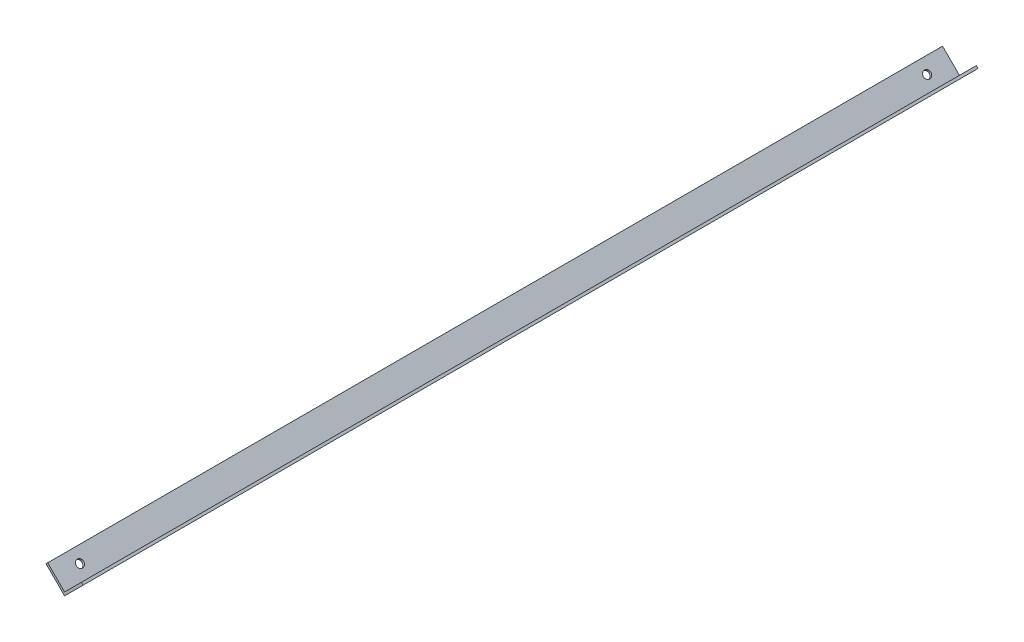
from build123d import *

# Parameters (mm, degrees)
BOSS_EXTRUDE1_DEPTH = 476.25
SKETCH2_R           = 1.984375
CUT_EXTRUDE1_DEPTH  = 477.43707659
SKETCH3_R           = 1.984375
CUT_EXTRUDE2_DEPTH  = 477.43707659
SKETCH4_R           = 1.984375
CUT_EXTRUDE3_DEPTH  = 477.43707659
SKETCH5_R           = 1.984375
CUT_EXTRUDE4_DEPTH  = 477.43707659


with BuildPart() as part:
    # Sketch1 → Boss-Extrude1 (new body)
    with BuildSketch(Plane.XY):
        Polygon((0, 0), (-8.980256121, 8.980256121), (-9.878281733, 8.082230509), (0, -1.796051224), (9.878281733, 8.082230509), (8.980256121, 8.980256121), align=None)
    extrude(amount=BOSS_EXTRUDE1_DEPTH)

    # Sketch2 → Cut-Extrude1 (cut, through all)
    with BuildSketch(Plane(origin=(0, 0, 0), x_dir=(0, 0, 1), z_dir=(-0.7071067811865469, 0.7071067811865481, 0))):
        with Locations(Location((469.9, 6.35, 0), (0, 0, 270))):
            Circle(SKETCH2_R)
        with Locations(Location((457.2, 6.35, 0), (0, 0, 270))):
            Circle(SKETCH2_R)
    extrude(amount=-CUT_EXTRUDE1_DEPTH, mode=Mode.SUBTRACT)

    # Sketch3 → Cut-Extrude2 (cut, through all)
    with BuildSketch(Plane(origin=(0, 0, 0), x_dir=(0, 0, -1), z_dir=(0.7071067811865483, 0.7071067811865468, 0))):
        with Locations(Location((-463.55, 6.35, 0), (0, 0, 90))):
            Circle(SKETCH3_R)
    extrude(amount=-CUT_EXTRUDE2_DEPTH, mode=Mode.SUBTRACT)

    # Sketch4 → Cut-Extrude3 (cut, through all)
    with BuildSketch(Plane(origin=(0, 0, 0), x_dir=(0, 0, 1), z_dir=(-0.7071067811865471, 0.7071067811865479, 0))):
        with Locations(Location((6.35, 6.35, 0), (0, 0, 270))):
            Circle(SKETCH4_R)
        with Locations(Location((19.05, 6.35, 0), (0, 0, 270))):
            Circle(SKETCH4_R)
    extrude(amount=-CUT_EXTRUDE3_DEPTH, mode=Mode.SUBTRACT)

    # Sketch5 → Cut-Extrude4 (cut, through all)
    with BuildSketch(Plane(origin=(0, 0, 0), x_dir=(0, 0, -1), z_dir=(0.7071067811865482, 0.7071067811865468, 0))):
        with Locations(Location((-12.7, 6.35, 0), (0, 0, 90))):
            Circle(SKETCH5_R)
    extrude(amount=-CUT_EXTRUDE4_DEPTH, mode=Mode.SUBTRACT)


solid = part.part
